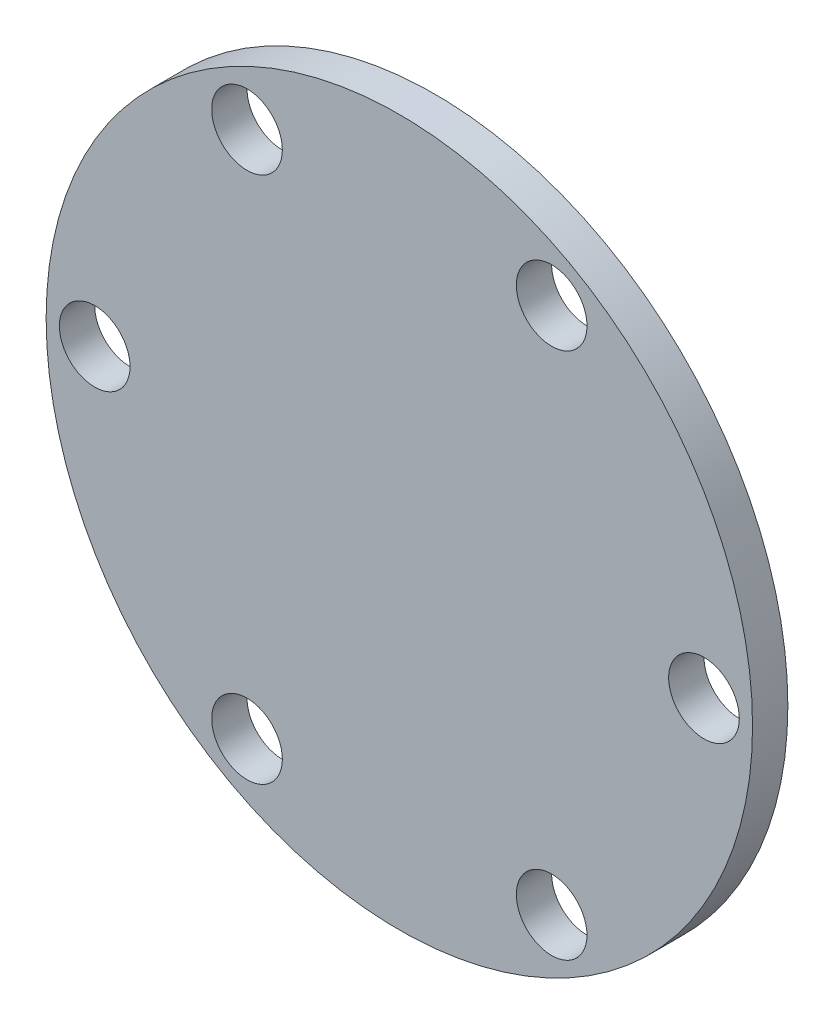
from build123d import *

# Parameters (mm, degrees)
SKETCH_1_R      = 20
SKETCH_1_R_2    = 2
EXTRUDE_1_DEPTH = 2


with BuildPart() as part:
    # 草图1 → 凸台-拉伸1 (new body)
    with BuildSketch(Plane.XY):
        Circle(SKETCH_1_R)
        with Locations((17.25, 0)):
            Circle(SKETCH_1_R_2, mode=Mode.SUBTRACT)
        with Locations((8.625, -14.938938215)):
            Circle(SKETCH_1_R_2, mode=Mode.SUBTRACT)
        with Locations((-8.625, -14.938938215)):
            Circle(SKETCH_1_R_2, mode=Mode.SUBTRACT)
        with Locations((-17.25, 0)):
            Circle(SKETCH_1_R_2, mode=Mode.SUBTRACT)
        with Locations((-8.625, 14.938938215)):
            Circle(SKETCH_1_R_2, mode=Mode.SUBTRACT)
        with Locations((8.625, 14.938938215)):
            Circle(SKETCH_1_R_2, mode=Mode.SUBTRACT)
    extrude(amount=EXTRUDE_1_DEPTH)


solid = part.part
